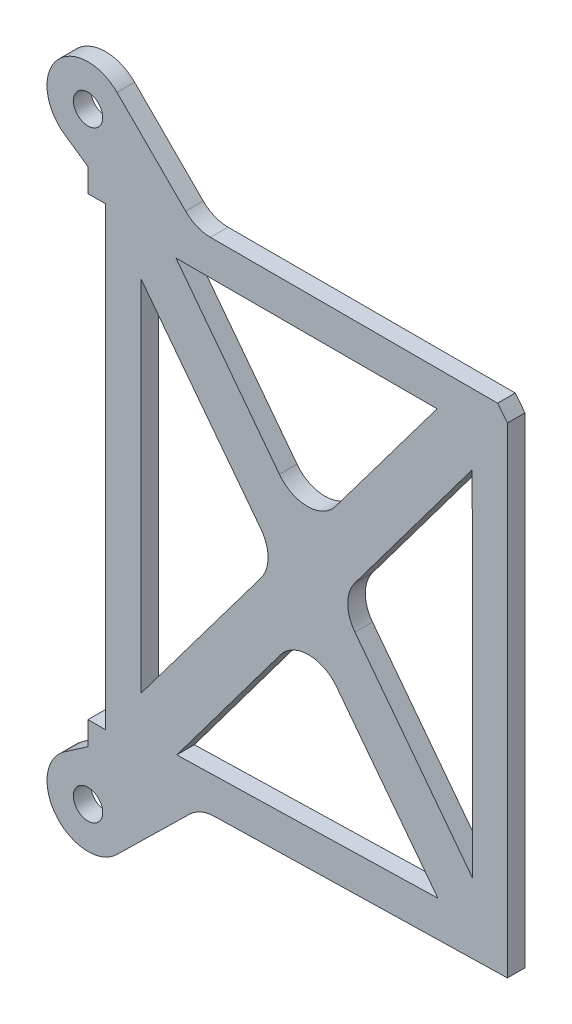
from build123d import *

# Parameters (mm, degrees)
MODEL_R         = 1.25
EXTRUDE_2_DEPTH = 1.5


with BuildPart() as part:
    # Model → 凸台-拉伸2 (new body)
    with BuildSketch(Plane.XY):
        with BuildLine():
            Line((567.23508643, 456.796470283), (573.081278388, 450.950276374))
            ThreePointArc((573.081278388, 450.950276374), (574.054548435, 450.29995812), (575.202598732, 450.071596717))
            Line((575.202598732, 450.071596717), (599.702598732, 450.071596717))
            Line((599.702598732, 450.071596717), (600.534867908, 449.022451897))
            Line((600.534867908, 449.022451897), (600.534867908, 408.022451897))
            Line((600.534867908, 408.022451897), (575.481922704, 407.463178676))
            ThreePointArc((575.481922704, 407.463178676), (574.371365784, 407.209391557), (573.427556635, 406.571450445))
            Line((573.427556635, 406.571450445), (568.455496448, 401.695722345))
            Line((568.455496448, 401.695722345), (567.235086299, 400.498957255))
            ThreePointArc((567.235086299, 400.498957255), (562.070444361, 400.734378517), (562.774755691, 405.856184357))
            Line((562.774755691, 405.856184357), (564.760216971, 407.22383333))
            Line((564.760216971, 407.22383333), (564.760216971, 409.22383333))
            Line((564.760216971, 409.22383333), (566.260216971, 409.22383333))
            Line((566.260216971, 409.22383333), (566.260216971, 448.071599095))
            Line((566.260216971, 448.071599095), (564.760216971, 448.071599095))
            Line((564.760216971, 448.071599095), (564.760216971, 450.071599095))
            Line((564.760216971, 450.071599095), (562.774760372, 451.439240088))
            ThreePointArc((562.774760372, 451.439240088), (562.070442602, 456.56104704), (567.23508643, 456.796470283))
        make_face()
        with Locations((564.760212527, 454.321596717)):
            Circle(MODEL_R, mode=Mode.SUBTRACT)
        with Locations((564.760212527, 402.973830952)):
            Circle(MODEL_R, mode=Mode.SUBTRACT)
        with BuildLine():
            ThreePointArc((579.517792138, 427.066754763), (580.118537337, 428.881766433), (579.50090837, 430.691102394))
            Line((579.50090837, 430.691102394), (569.260212527, 444.071596717))
            Line((569.260212527, 444.071596717), (569.260212527, 413.402282802))
            Line((569.260212527, 413.402282802), (579.517792138, 427.066754763))
        make_face(mode=Mode.SUBTRACT)
        with BuildLine():
            ThreePointArc((581.084435265, 435.507954993), (583.481204613, 434.327912105), (585.868577071, 435.526852168))
            Line((585.868577071, 435.526852168), (594.534929977, 447.071596717))
            Line((594.534929977, 447.071596717), (572.260212527, 447.071596717))
            Line((572.260212527, 447.071596717), (581.084435265, 435.507954993))
        make_face(mode=Mode.SUBTRACT)
        with BuildLine():
            ThreePointArc((585.96375898, 422.246741072), (583.565361337, 423.423386992), (581.179698264, 422.221131371))
            Line((581.179698264, 422.221131371), (572.333907172, 410.403188089))
            Line((572.333907172, 410.403188089), (594.609247843, 410.950544366))
            Line((594.609247843, 410.950544366), (585.96375898, 422.246741072))
        make_face(mode=Mode.SUBTRACT)
        with BuildLine():
            ThreePointArc((587.511830306, 430.680835717), (586.913584899, 428.869200497), (587.528632984, 427.063200611))
            Line((587.528632984, 427.063200611), (597.535553197, 413.949701149))
            Line((597.535553197, 413.949701149), (597.534929977, 444.071658787))
            Line((597.534929977, 444.071658787), (587.511830306, 430.680835717))
        make_face(mode=Mode.SUBTRACT)
    extrude(amount=EXTRUDE_2_DEPTH)


solid = part.part
